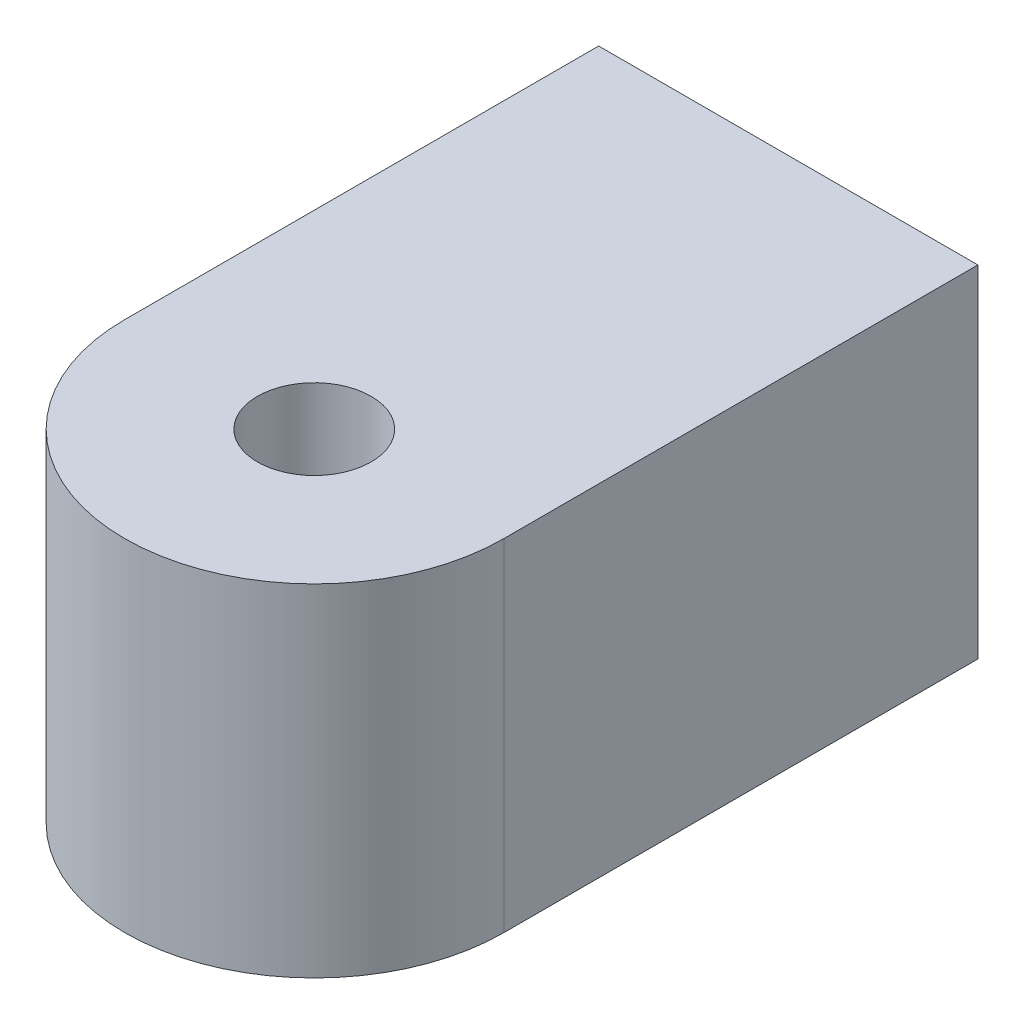
from build123d import *

# Parameters (mm, degrees)
SKETCH2_R           = 50
SKETCH2_R_2         = 15
BOSS_EXTRUDE1_DEPTH = 90
BOSS_EXTRUDE2_START = -90
BOSS_EXTRUDE2_DEPTH = 90
SKETCH4_R           = 15
BOSS_EXTRUDE3_DEPTH = 25


with BuildPart() as part:
    # Sketch2 → Boss-Extrude1 (new body)
    with BuildSketch(Plane(origin=(0, 0, 0), x_dir=(1, 0, 0), z_dir=(0, 1, 0))):
        with Locations(Location((0, 0, 0), (0, 0, 90))):
            Circle(SKETCH2_R)
        with Locations(Location((0, 0, 0), (0, 0, 90))):
            Circle(SKETCH2_R_2, mode=Mode.SUBTRACT)
    extrude(amount=BOSS_EXTRUDE1_DEPTH)

    # Sketch3 → Boss-Extrude2 (add)
    with BuildSketch(Plane(origin=(0, 90, 0), x_dir=(1, 0, 0), z_dir=(0, 1, 0)).offset(BOSS_EXTRUDE2_START)):
        with BuildLine():
            Line((-50, 0), (-50, 125))
            Line((-50, 125), (50, 125))
            Line((50, 125), (50, 0))
            ThreePointArc((50, 0), (0, 50), (-50, 0))
        make_face()
    extrude(amount=BOSS_EXTRUDE2_DEPTH)

    # Sketch4 → Boss-Extrude3 (add)
    with BuildSketch(Plane(origin=(0, 0, -125), x_dir=(-1, 0, 0), z_dir=(0, 0, -1))):
        with Locations((0, 47.976232204)):
            Circle(SKETCH4_R)
    extrude(amount=BOSS_EXTRUDE3_DEPTH)


solid = part.part
